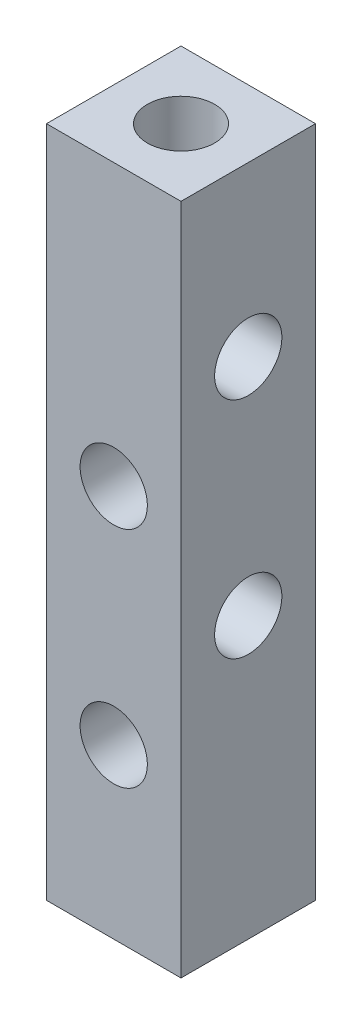
from build123d import *

# Parameters (mm, degrees)
SKETCH_1_W          = 6
SKETCH_1_H          = 6
EXTRUDE_1_DEPTH     = 30
CUT_EXTRUDE_1_REACH = 32.741
SKETCH_2_R          = 1.5
CUT_EXTRUDE_2_REACH = 32.741
SKETCH_3_R          = 1.5
SKETCH_4_R          = 1.5
CUT_EXTRUDE_3_DEPTH = 5
CUT_EXTRUDE_START   = -5
SKETCH_5_R          = 1.5
CUT_EXTRUDE_4_DEPTH = 5


with BuildPart() as part:
    # 草图1 → 凸台-拉伸1 (new body)
    with BuildSketch(Plane(origin=(0, 0, 0), x_dir=(1, 0, 0), z_dir=(0, 1, 0))):
        Rectangle(SKETCH_1_W, SKETCH_1_H)
    extrude(amount=EXTRUDE_1_DEPTH)

    # 草图2 → 切除-拉伸1 (cut, up to next)
    with BuildSketch(Plane.XY.offset(3), mode=Mode.PRIVATE) as cut_extrude_1_sk1:
        with Locations((0, 17.5)):
            Circle(SKETCH_2_R)
    cut_extrude_1_tool1 = extrude(cut_extrude_1_sk1.sketch, amount=-CUT_EXTRUDE_1_REACH, mode=Mode.PRIVATE) & part.part
    # 草图2 → 切除-拉伸1 (cut, up to next)
    with BuildSketch(Plane.XY.offset(3), mode=Mode.PRIVATE) as cut_extrude_1_sk2:
        with Locations((0, 7.5)):
            Circle(SKETCH_2_R)
    cut_extrude_1_tool2 = extrude(cut_extrude_1_sk2.sketch, amount=-CUT_EXTRUDE_1_REACH, mode=Mode.PRIVATE) & part.part
    add(cut_extrude_1_tool1.solids().sort_by_distance((0, 17.5, 3))[0], mode=Mode.SUBTRACT)
    add(cut_extrude_1_tool2.solids().sort_by_distance((0, 7.5, 3))[0], mode=Mode.SUBTRACT)

    # 草图3 → 切除-拉伸2 (cut, up to next)
    with BuildSketch(Plane(origin=(3, 0, 0), x_dir=(0, 0, -1), z_dir=(1, 0, 0)), mode=Mode.PRIVATE) as cut_extrude_2_sk1:
        with Locations((0, 22.5)):
            Circle(SKETCH_3_R)
    cut_extrude_2_tool1 = extrude(cut_extrude_2_sk1.sketch, amount=-CUT_EXTRUDE_2_REACH, mode=Mode.PRIVATE) & part.part
    # 草图3 → 切除-拉伸2 (cut, up to next)
    with BuildSketch(Plane(origin=(3, 0, 0), x_dir=(0, 0, -1), z_dir=(1, 0, 0)), mode=Mode.PRIVATE) as cut_extrude_2_sk2:
        with Locations((0, 12.5)):
            Circle(SKETCH_3_R)
    cut_extrude_2_tool2 = extrude(cut_extrude_2_sk2.sketch, amount=-CUT_EXTRUDE_2_REACH, mode=Mode.PRIVATE) & part.part
    add(cut_extrude_2_tool1.solids().sort_by_distance((3, 22.5, 0))[0], mode=Mode.SUBTRACT)
    add(cut_extrude_2_tool2.solids().sort_by_distance((3, 12.5, 0))[0], mode=Mode.SUBTRACT)

    # 草图4 → 切除-拉伸3 (cut)
    with BuildSketch(Plane(origin=(0, 30, 0), x_dir=(1, 0, 0), z_dir=(0, 1, 0))):
        with Locations(Location((0, 0, 0), (0, 0, 270))):
            Circle(SKETCH_4_R)
    extrude(amount=-CUT_EXTRUDE_3_DEPTH, mode=Mode.SUBTRACT)

    # 草图5 → 切除-拉伸4 (cut)
    with BuildSketch(Plane.XZ.offset(CUT_EXTRUDE_START)):
        with Locations(Location((0, 0, 0), (0, 0, 90))):
            Circle(SKETCH_5_R)
    extrude(amount=CUT_EXTRUDE_4_DEPTH, mode=Mode.SUBTRACT)


solid = part.part
